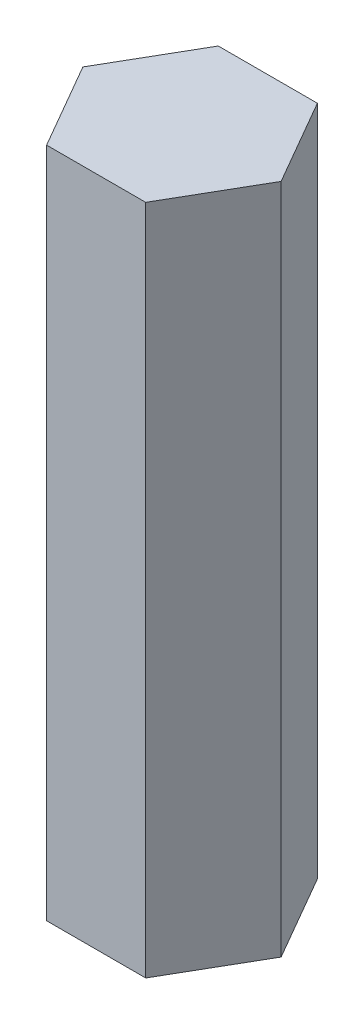
from build123d import *

# Parameters (mm, degrees)
BOSS_EXTRUDE1_DEPTH = 18


with BuildPart() as part:
    # Sketch1 → Boss-Extrude1 (new body)
    with BuildSketch(Plane(origin=(0, 0, 0), x_dir=(1, 0, 0), z_dir=(0, 1, 0))):
        Polygon((2.655811238, 0), (1.327905619, 2.3), (-1.327905619, 2.3), (-2.655811238, 0), (-1.327905619, -2.3), (1.327905619, -2.3), align=None)
    extrude(amount=BOSS_EXTRUDE1_DEPTH)


solid = part.part
